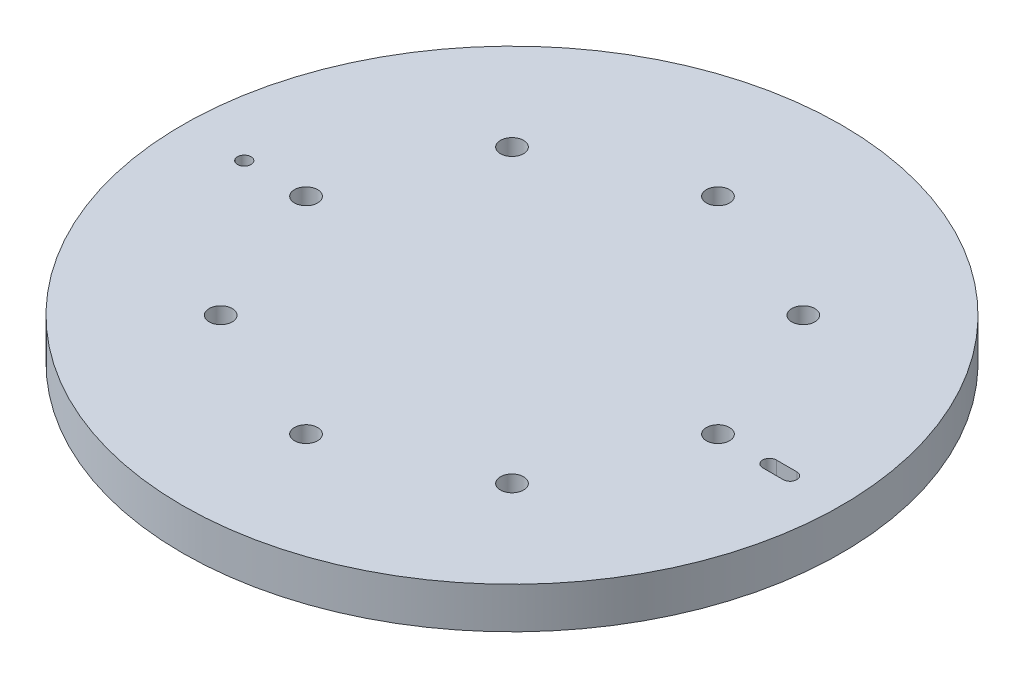
from build123d import *

# Parameters (mm, degrees)
SKETCH1_W               = 101.6
SKETCH1_H               = 12.7
CUT_EXTRUDE1_DEPTH      = 145.244271983
CUT_EXTRUDE1_DEPTH_BACK = 145.244271983
SKETCH2_R               = 3.5687
SKETCH3_R               = 2.0955
CUT_EXTRUDE4_DEPTH      = 31.75


with BuildPart() as part:
    # Sketch1 → Revolve1 (revolve)
    with BuildSketch(Plane(origin=(0, 0, 0), x_dir=(0, 0, -1), z_dir=(1, 0, 0)), mode=Mode.PRIVATE) as revolve1_sk:
        with Locations((50.8, 6.35)):
            Rectangle(SKETCH1_W, SKETCH1_H)
    revolve(revolve1_sk.sketch.rotate(Axis((0, 46.9, 0), (0, -1, 0)), 180), axis=Axis((0, 46.9, 0), (0, -1, 0)))

    # Sketch2 → Cut-Extrude1 (cut, two sides: drawn at the far end of the back side and taken through both)
    with BuildSketch(Plane(origin=(0, 12.7, 0), x_dir=(1, 0, 0), z_dir=(0, 1, 0)).offset(-CUT_EXTRUDE1_DEPTH_BACK)):
        with Locations(Location((0, 63.5, 0), (0, 0, 270))):
            Circle(SKETCH2_R)
        with Locations(Location((44.901280605, 44.901280605, 0), (0, 0, 270))):
            Circle(SKETCH2_R)
        with Locations(Location((63.5, 0, 0), (0, 0, 270))):
            Circle(SKETCH2_R)
        with Locations(Location((44.901280605, -44.901280605, 0), (0, 0, 270))):
            Circle(SKETCH2_R)
        with Locations(Location((0, -63.5, 0), (0, 0, 270))):
            Circle(SKETCH2_R)
        with Locations(Location((-44.901280605, -44.901280605, 0), (0, 0, 270))):
            Circle(SKETCH2_R)
        with Locations(Location((-63.5, 0, 0), (0, 0, 270))):
            Circle(SKETCH2_R)
        with Locations(Location((-44.901280605, 44.901280605, 0), (0, 0, 270))):
            Circle(SKETCH2_R)
    extrude(amount=CUT_EXTRUDE1_DEPTH + CUT_EXTRUDE1_DEPTH_BACK, mode=Mode.SUBTRACT)

    # Sketch3 → Cut-Extrude4 (cut)
    with BuildSketch(Plane(origin=(0, 12.7, 0), x_dir=(1, 0, 0), z_dir=(0, 1, 0))):
        with Locations(Location((-82.55, 0, 0), (0, 0, 270))):
            Circle(SKETCH3_R)
        with BuildLine():
            Line((79.375, -2.0955), (85.725, -2.0955))
            ThreePointArc((85.725, -2.0955), (87.8205, 0), (85.725, 2.0955))
            Line((85.725, 2.0955), (79.375, 2.0955))
            ThreePointArc((79.375, 2.0955), (77.2795, 0), (79.375, -2.0955))
        make_face()
    extrude(amount=-CUT_EXTRUDE4_DEPTH, mode=Mode.SUBTRACT)


solid = part.part
